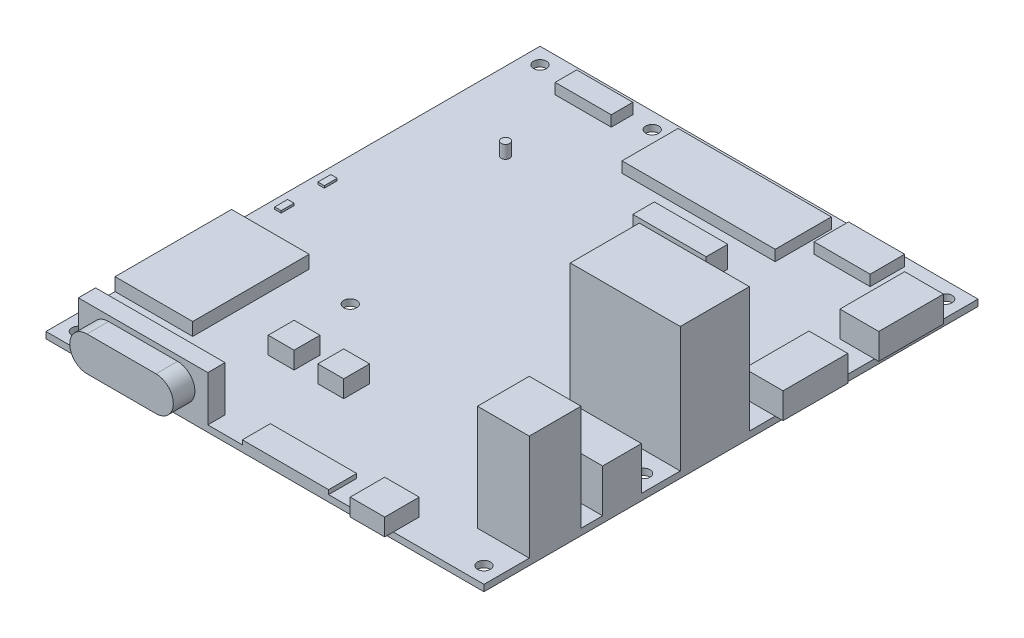
from build123d import *

# Parameters (mm, degrees)
SKETCH1_W                  = 101.5
SKETCH1_H                  = 114.5
TR_KKPLAAT_DEPTH           = 1.5
SKETCH2_R                  = 1.5
AUGUD_DEPTH                = 1.5
SKETCH3_W                  = 35.5
SKETCH3_H                  = 13
EXP_CONN_A_B_DEPTH         = 2.5
SKETCH4_W                  = 13
SKETCH4_H                  = 8
LCD_CONN_A_B_DEPTH         = 2.5
SKETCH5_W                  = 13
SKETCH5_H                  = 5
WIFI_BT_DEPTH              = 2.5
SKETCH6_W                  = 17
SKETCH6_H                  = 5
JTAG_DEPTH                 = 5
SKETCH7_W                  = 9
SKETCH7_H                  = 15
HDMI_A_B_DEPTH             = 6
SKETCH8_W                  = 25.5
SKETCH8_H                  = 16
USB_ETHERNET_DEPTH         = 29
SKETCH9_W                  = 14
SKETCH9_H                  = 9
F_5V_IN_DEPTH              = 10
SKETCH10_W                 = 12
SKETCH10_H                 = 12
HEADPHONE_DEPTH            = 24.5
SKETCH11_W                 = 8
SKETCH11_H                 = 8
MINI_USB_DEPTH             = 4
SKETCH12_W                 = 30
SKETCH12_H                 = 4
BOSS_EXTRUDE11_DEPTH       = 10.5
BOSS_EXTRUDE12_DEPTH       = 5
SKETCH14_W                 = 18
SKETCH14_H                 = 27
SD_CARD_SLOT_DEPTH         = 3
SKETCH15_W                 = 1.5
SKETCH15_H                 = 3
STATUS_LED_DEPTH           = 0.5
SKETCH16_W                 = 6
SKETCH16_H                 = 6
PWRON_RESET_GPIO_121_DEPTH = 4
SKETCH17_W                 = 20
SKETCH17_H                 = 6.5
CAMERA_CONN_DEPTH          = 1
SKETCH18_R                 = 1
WIFI_BT_ANTENNA_DEPTH      = 3


with BuildPart() as part:
    # Sketch1 → trükkplaat (new body)
    with BuildSketch(Plane(origin=(0, 0, 0), x_dir=(1, 0, 0), z_dir=(0, 1, 0))):
        Rectangle(SKETCH1_W, SKETCH1_H)
    extrude(amount=TR_KKPLAAT_DEPTH)

    # Sketch2 → augud (cut)
    with BuildSketch(Plane(origin=(0, 1.5, 0), x_dir=(1, 0, 0), z_dir=(0, 1, 0))):
        with Locations(Location((-47, 53.5, 0), (0, 0, 270))):
            Circle(SKETCH2_R)
        with Locations(Location((47, 53.5, 0), (0, 0, 270))):
            Circle(SKETCH2_R)
        with Locations(Location((47, -53.5, 0), (0, 0, 270))):
            Circle(SKETCH2_R)
        with Locations(Location((-47, -53.5, 0), (0, 0, 270))):
            Circle(SKETCH2_R)
        with Locations(Location((-21, 53.5, 0), (0, 0, 270))):
            Circle(SKETCH2_R)
        with Locations(Location((-21, -16.5, 0), (0, 0, 270))):
            Circle(SKETCH2_R)
        with Locations(Location((47, -16.5, 0), (0, 0, 270))):
            Circle(SKETCH2_R)
    extrude(amount=-AUGUD_DEPTH, mode=Mode.SUBTRACT)

    # Sketch3 → exp. conn. A/B (add)
    with BuildSketch(Plane(origin=(0, 1.5, 0), x_dir=(1, 0, 0), z_dir=(0, 1, 0))):
        with Locations((2, 47.75)):
            Rectangle(SKETCH3_W, SKETCH3_H)
    extrude(amount=EXP_CONN_A_B_DEPTH)

    # Sketch4 → LCD conn. A/B (add)
    with BuildSketch(Plane(origin=(0, 1.5, 0), x_dir=(1, 0, 0), z_dir=(0, 1, 0))):
        with Locations((29.25, 51.25)):
            Rectangle(SKETCH4_W, SKETCH4_H)
    extrude(amount=LCD_CONN_A_B_DEPTH)

    # Sketch5 → WIFI/BT (add)
    with BuildSketch(Plane(origin=(0, 1.5, 0), x_dir=(1, 0, 0), z_dir=(0, 1, 0))):
        with Locations((-32.75, 51.75)):
            Rectangle(SKETCH5_W, SKETCH5_H)
    extrude(amount=WIFI_BT_DEPTH)

    # Sketch6 → JTAG (add)
    with BuildSketch(Plane(origin=(0, 1.5, 0), x_dir=(1, 0, 0), z_dir=(0, 1, 0))):
        with Locations((7.25, 31.75)):
            Rectangle(SKETCH6_W, SKETCH6_H)
    extrude(amount=JTAG_DEPTH)

    # Sketch7 → HDMI A/B (add)
    with BuildSketch(Plane(origin=(0, 1.5, 0), x_dir=(1, 0, 0), z_dir=(0, 1, 0))):
        with Locations((47.25, 40.75)):
            Rectangle(SKETCH7_W, SKETCH7_H)
        with Locations((48.068861521, 17.75)):
            Rectangle(SKETCH7_W, SKETCH7_H)
    extrude(amount=HDMI_A_B_DEPTH)

    # Sketch8 → USB/Ethernet (add)
    with BuildSketch(Plane(origin=(0, 1.5, 0), x_dir=(1, 0, 0), z_dir=(0, 1, 0))):
        with Locations((38, -3.75)):
            Rectangle(SKETCH8_W, SKETCH8_H)
    extrude(amount=USB_ETHERNET_DEPTH)

    # Sketch9 → 5V in (add)
    with BuildSketch(Plane(origin=(0, 1.5, 0), x_dir=(1, 0, 0), z_dir=(0, 1, 0))):
        with Locations((43.75, -25.25)):
            Rectangle(SKETCH9_W, SKETCH9_H)
    extrude(amount=F_5V_IN_DEPTH)

    # Sketch10 → Headphone (add)
    with BuildSketch(Plane(origin=(0, 1.5, 0), x_dir=(1, 0, 0), z_dir=(0, 1, 0))):
        with Locations((44.75, -40.75)):
            Rectangle(SKETCH10_W, SKETCH10_H)
    extrude(amount=HEADPHONE_DEPTH)

    # Sketch11 → mini-USB (add)
    with BuildSketch(Plane(origin=(0, 1.5, 0), x_dir=(1, 0, 0), z_dir=(0, 1, 0))):
        with Locations((25.75, -55.25)):
            Rectangle(SKETCH11_W, SKETCH11_H)
    extrude(amount=MINI_USB_DEPTH)

    # Sketch12 → Boss-Extrude11 (add)
    with BuildSketch(Plane(origin=(0, 1.5, 0), x_dir=(1, 0, 0), z_dir=(0, 1, 0))):
        with Locations((-28.25, -55.25)):
            Rectangle(SKETCH12_W, SKETCH12_H)
    extrude(amount=BOSS_EXTRUDE11_DEPTH)

    # Sketch13 → Boss-Extrude12 (add)
    with BuildSketch(Plane.XY.offset(57.25)):
        with BuildLine():
            Line((-36.25, 10.75), (-20.25, 10.75))
            ThreePointArc((-20.25, 10.75), (-16.25, 6.75), (-20.25, 2.75))
            Line((-20.25, 2.75), (-36.25, 2.75))
            ThreePointArc((-36.25, 2.75), (-40.25, 6.75), (-36.25, 10.75))
        make_face()
    extrude(amount=BOSS_EXTRUDE12_DEPTH)

    # Sketch14 → SD-card slot (add)
    with BuildSketch(Plane(origin=(0, 1.5, 0), x_dir=(1, 0, 0), z_dir=(0, 1, 0))):
        with Locations((-41.75, -27.75)):
            Rectangle(SKETCH14_W, SKETCH14_H)
    extrude(amount=SD_CARD_SLOT_DEPTH)

    # Sketch15 → status LED (add)
    with BuildSketch(Plane(origin=(0, 1.5, 0), x_dir=(1, 0, 0), z_dir=(0, 1, 0))):
        with Locations((-48, -4.75)):
            Rectangle(SKETCH15_W, SKETCH15_H)
        with Locations((-48, 5.25)):
            Rectangle(SKETCH15_W, SKETCH15_H)
    extrude(amount=STATUS_LED_DEPTH)

    # Sketch16 → PWRON_RESET/GPIO_121 (add)
    with BuildSketch(Plane(origin=(0, 1.5, 0), x_dir=(1, 0, 0), z_dir=(0, 1, 0))):
        with Locations((-5.75, -33.25)):
            Rectangle(SKETCH16_W, SKETCH16_H)
        with Locations((-17.25, -33.25)):
            Rectangle(SKETCH16_W, SKETCH16_H)
    extrude(amount=PWRON_RESET_GPIO_121_DEPTH)

    # Sketch17 → camera conn (add)
    with BuildSketch(Plane(origin=(0, 1.5, 0), x_dir=(1, 0, 0), z_dir=(0, 1, 0))):
        with Locations((4.75, -54)):
            Rectangle(SKETCH17_W, SKETCH17_H)
    extrude(amount=CAMERA_CONN_DEPTH)

    # Sketch18 → WIFI?/BT? antenna (add)
    with BuildSketch(Plane(origin=(0, 1.5, 0), x_dir=(1, 0, 0), z_dir=(0, 1, 0))):
        with Locations(Location((-32.75, 31.25, 0), (0, 0, 90))):
            Circle(SKETCH18_R)
    extrude(amount=WIFI_BT_ANTENNA_DEPTH)


solid = part.part
